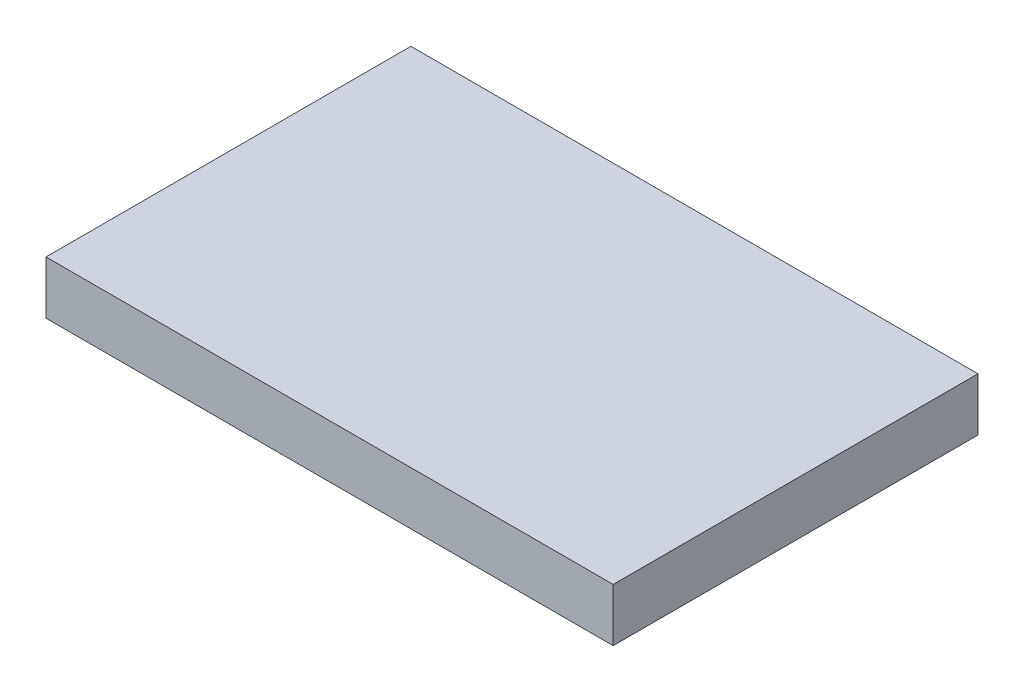
from build123d import *

# Parameters (mm, degrees)
SKETCH1_W           = 81.5
SKETCH1_H           = 51
BOSS_EXTRUDE1_DEPTH = 2
SKETCH2_W           = 85.5
SKETCH2_H           = 55
SKETCH2_W_2         = 81.5
SKETCH2_H_2         = 51
BOSS_EXTRUDE2_DEPTH = 8


with BuildPart() as part:
    # Sketch1 → Boss-Extrude1 (new body)
    with BuildSketch(Plane(origin=(0, 0, 0), x_dir=(1, 0, 0), z_dir=(0, 1, 0))):
        with Locations((40.75, -25.5)):
            Rectangle(SKETCH1_W, SKETCH1_H)
    extrude(amount=BOSS_EXTRUDE1_DEPTH)

    # Sketch2 → Boss-Extrude2 (add)
    with BuildSketch(Plane(origin=(0, 2, 0), x_dir=(1, 0, 0), z_dir=(0, 1, 0))):
        with Locations((40.75, -25.5)):
            Rectangle(SKETCH2_W, SKETCH2_H)
        with Locations((40.75, -25.5)):
            Rectangle(SKETCH2_W_2, SKETCH2_H_2, mode=Mode.SUBTRACT)
    extrude(amount=-BOSS_EXTRUDE2_DEPTH)


solid = part.part
